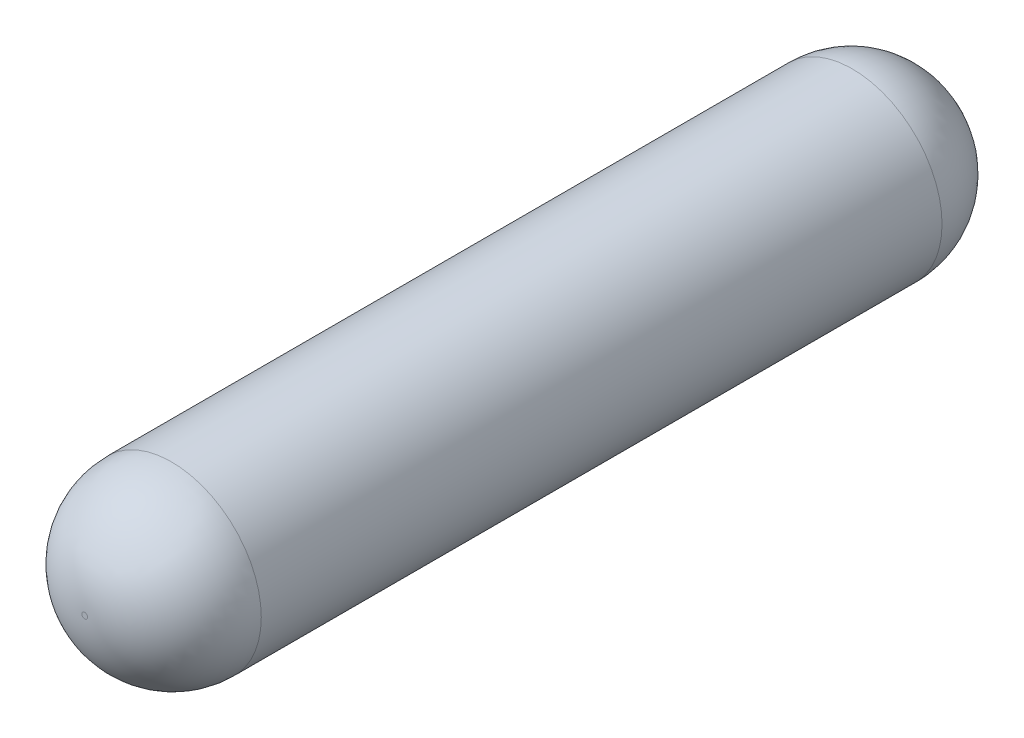
from build123d import *

# Parameters (mm, degrees)
SKETCH1_R           = 6.3
BOSS_EXTRUDE1_DEPTH = 60
FILLET1_R           = 6.1


with BuildPart() as part:
    # Sketch1 → Boss-Extrude1 (new body)
    with BuildSketch(Plane.XY):
        Circle(SKETCH1_R)
    extrude(amount=BOSS_EXTRUDE1_DEPTH)

    # Fillet1
    fillet1_edges = [part.edges().sort_by_distance(p)[0] for p in [
        (-6.3, 0, 0),
        (-6.3, 0, 60),
    ]]
    fillet(fillet1_edges, radius=FILLET1_R)


solid = part.part
